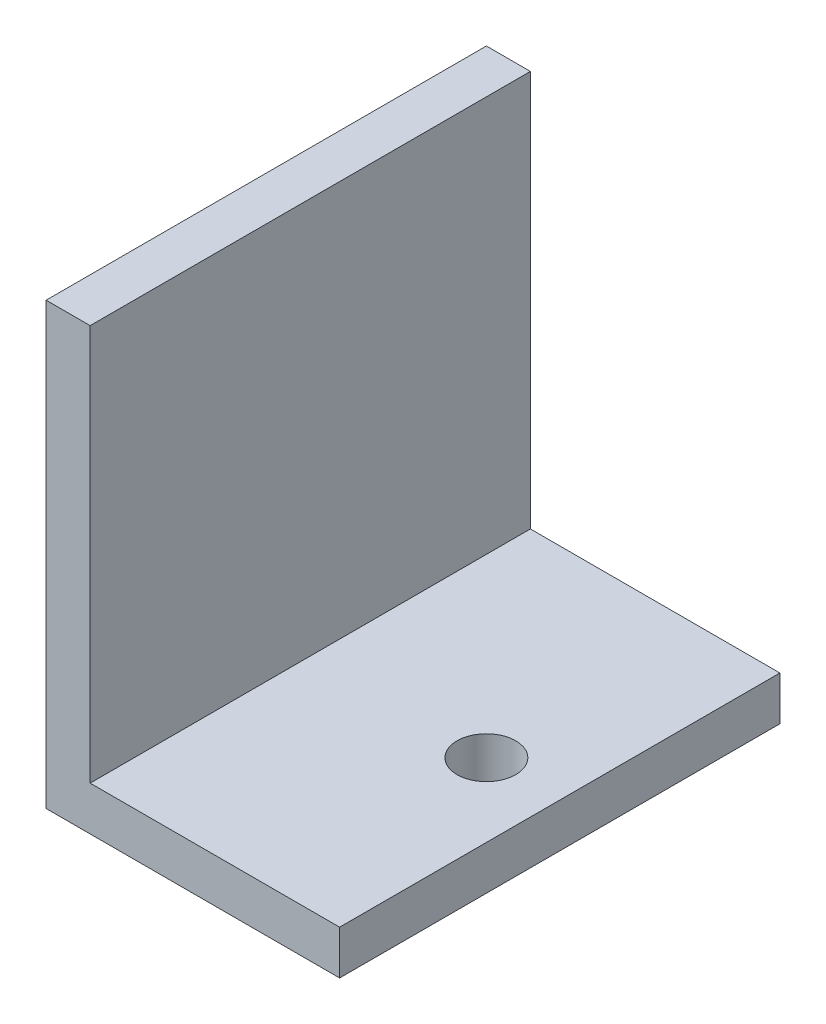
from build123d import *

# Parameters (mm, degrees)
BOSS_EXTRUDE1_DEPTH = 30
SKETCH2_R           = 2
CUT_EXTRUDE1_DEPTH  = 30
SKETCH3_W           = 10
SKETCH3_H           = 30
CUT_EXTRUDE2_DEPTH  = 6


with BuildPart() as part:
    # Sketch1 → Boss-Extrude1 (new body)
    with BuildSketch(Plane(origin=(0, 0, 0), x_dir=(0, 1, 0), z_dir=(0, 0, 1))):
        Polygon((0, 0), (-30, 0), (-30, -30), (-27, -30), (-27, -3), (0, -3), align=None)
    extrude(amount=BOSS_EXTRUDE1_DEPTH)

    # Sketch2 → Cut-Extrude1 (cut)
    with BuildSketch(Plane(origin=(0, -27, 0), x_dir=(-1, 0, 0), z_dir=(0, 1, 0))):
        with Locations(Location((-15, 15, 0), (0, 0, 90))):
            Circle(SKETCH2_R)
    extrude(amount=-CUT_EXTRUDE1_DEPTH, mode=Mode.SUBTRACT)

    # Sketch3 → Cut-Extrude2 (cut)
    with BuildSketch(Plane(origin=(0, -27, 0), x_dir=(-1, 0, 0), z_dir=(0, 1, 0))):
        with Locations((-25, 15)):
            Rectangle(SKETCH3_W, SKETCH3_H)
    extrude(amount=-CUT_EXTRUDE2_DEPTH, mode=Mode.SUBTRACT)


solid = part.part
